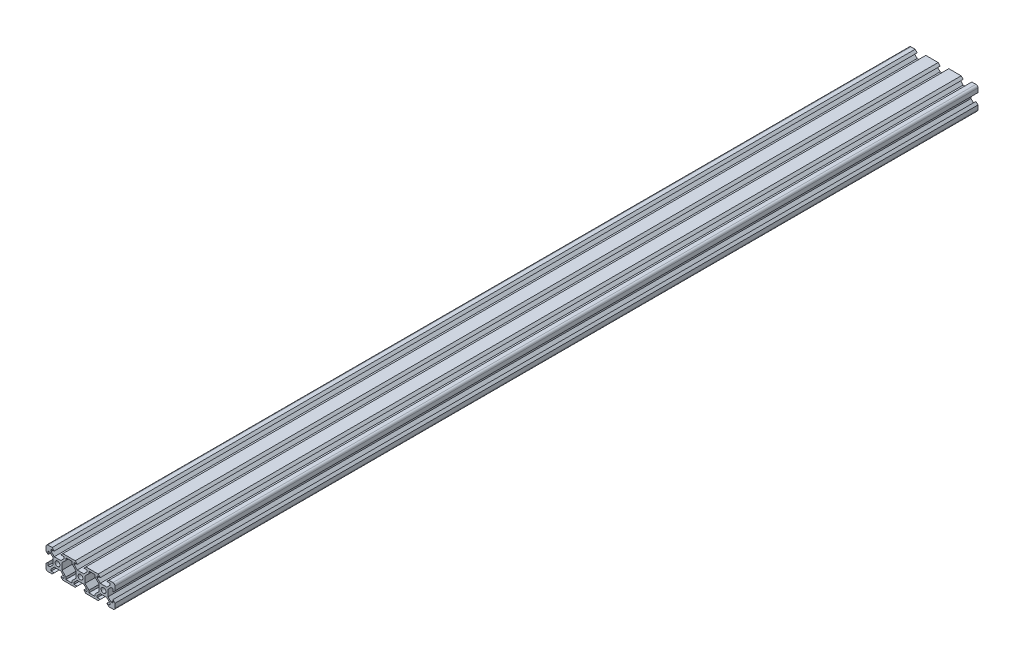
from build123d import *

# Parameters (mm, degrees)
SKETCH1_R           = 2.1
BOSS_EXTRUDE1_DEPTH = 750


with BuildPart() as part:
    # Sketch1 → Boss-Extrude1 (new body)
    with BuildSketch(Plane.XY.offset(10)):
        with BuildLine():
            Line((-12.84, -8.2), (-15.499339828, -8.2))
            Line((-15.499339828, -8.2), (-15.499339828, -6.56))
            Line((-15.499339828, -6.56), (-12.84, -3.900660172))
            Line((-12.84, -3.900660172), (-7.16, -3.900660172))
            Line((-7.16, -3.900660172), (-4.500660172, -6.56))
            Line((-4.500660172, -6.56), (-4.500660172, -8.2))
            Line((-4.500660172, -8.2), (-7.16, -8.2))
            Line((-7.16, -8.2), (-5.36, -10))
            Line((-5.36, -10), (5.36, -10))
            Line((5.36, -10), (7.16, -8.2))
            Line((7.16, -8.2), (4.500660172, -8.2))
            Line((4.500660172, -8.2), (4.500660172, -6.56))
            Line((4.500660172, -6.56), (7.16, -3.900660172))
            Line((7.16, -3.900660172), (12.84, -3.900660172))
            Line((12.84, -3.900660172), (15.499339828, -6.56))
            Line((15.499339828, -6.56), (15.499339828, -8.2))
            Line((15.499339828, -8.2), (12.84, -8.2))
            Line((12.84, -8.2), (14.64, -10))
            Line((14.64, -10), (18.2, -10))
            ThreePointArc((18.2, -10), (19.472792206, -9.472792206), (20, -8.2))
            Line((20, -8.2), (20, -4.64))
            Line((20, -4.64), (18.2, -2.84))
            Line((18.2, -2.84), (18.2, -5.499339828))
            Line((18.2, -5.499339828), (16.56, -5.499339828))
            Line((16.56, -5.499339828), (13.900660172, -2.84))
            Line((13.900660172, -2.84), (13.900660172, 2.84))
            Line((13.900660172, 2.84), (16.56, 5.499339828))
            Line((16.56, 5.499339828), (18.2, 5.499339828))
            Line((18.2, 5.499339828), (18.2, 2.84))
            Line((18.2, 2.84), (20, 4.64))
            Line((20, 4.64), (20, 8.2))
            ThreePointArc((20, 8.2), (19.472792206, 9.472792206), (18.2, 10))
            Line((18.2, 10), (14.64, 10))
            Line((14.64, 10), (12.84, 8.2))
            Line((12.84, 8.2), (15.499339828, 8.2))
            Line((15.499339828, 8.2), (15.499339828, 6.56))
            Line((15.499339828, 6.56), (12.84, 3.900660172))
            Line((12.84, 3.900660172), (7.16, 3.900660172))
            Line((7.16, 3.900660172), (4.500660172, 6.56))
            Line((4.500660172, 6.56), (4.500660172, 8.2))
            Line((4.500660172, 8.2), (7.16, 8.2))
            Line((7.16, 8.2), (5.36, 10))
            Line((5.36, 10), (-5.36, 10))
            Line((-5.36, 10), (-7.16, 8.2))
            Line((-7.16, 8.2), (-4.500660172, 8.2))
            Line((-4.500660172, 8.2), (-4.500660172, 6.56))
            Line((-4.500660172, 6.56), (-7.16, 3.900660172))
            Line((-7.16, 3.900660172), (-12.84, 3.900660172))
            Line((-12.84, 3.900660172), (-15.499339828, 6.56))
            Line((-15.499339828, 6.56), (-15.499339828, 8.2))
            Line((-15.499339828, 8.2), (-12.84, 8.2))
            Line((-12.84, 8.2), (-14.64, 10))
            Line((-14.64, 10), (-25.36, 10))
            Line((-25.36, 10), (-27.16, 8.2))
            Line((-27.16, 8.2), (-24.500660172, 8.2))
            Line((-24.500660172, 8.2), (-24.500660172, 6.56))
            Line((-24.500660172, 6.56), (-27.16, 3.900660172))
            Line((-27.16, 3.900660172), (-32.84, 3.900660172))
            Line((-32.84, 3.900660172), (-35.499339828, 6.56))
            Line((-35.499339828, 6.56), (-35.499339828, 8.2))
            Line((-35.499339828, 8.2), (-32.84, 8.2))
            Line((-32.84, 8.2), (-34.64, 10))
            Line((-34.64, 10), (-38.2, 10))
            ThreePointArc((-38.2, 10), (-39.472792206, 9.472792206), (-40, 8.2))
            Line((-40, 8.2), (-40, 4.64))
            Line((-40, 4.64), (-38.2, 2.84))
            Line((-38.2, 2.84), (-38.2, 5.499339828))
            Line((-38.2, 5.499339828), (-36.56, 5.499339828))
            Line((-36.56, 5.499339828), (-33.900660172, 2.84))
            Line((-33.900660172, 2.84), (-33.900660172, -2.84))
            Line((-33.900660172, -2.84), (-36.56, -5.499339828))
            Line((-36.56, -5.499339828), (-38.2, -5.499339828))
            Line((-38.2, -5.499339828), (-38.2, -2.84))
            Line((-38.2, -2.84), (-40, -4.64))
            Line((-40, -4.64), (-40, -8.2))
            ThreePointArc((-40, -8.2), (-39.472792206, -9.472792206), (-38.2, -10))
            Line((-38.2, -10), (-34.64, -10))
            Line((-34.64, -10), (-32.84, -8.2))
            Line((-32.84, -8.2), (-35.499339828, -8.2))
            Line((-35.499339828, -8.2), (-35.499339828, -6.56))
            Line((-35.499339828, -6.56), (-32.84, -3.900660172))
            Line((-32.84, -3.900660172), (-27.16, -3.900660172))
            Line((-27.16, -3.900660172), (-24.500660172, -6.56))
            Line((-24.500660172, -6.56), (-24.500660172, -8.2))
            Line((-24.500660172, -8.2), (-27.16, -8.2))
            Line((-27.16, -8.2), (-25.36, -10))
            Line((-25.36, -10), (-14.64, -10))
            Line((-14.64, -10), (-12.84, -8.2))
        make_face()
        with Locations(Location((-10, 0, 0), (0, 0, 180))):
            Circle(SKETCH1_R, mode=Mode.SUBTRACT)
        with Locations(Location((-30, 0, 0), (0, 0, 180))):
            Circle(SKETCH1_R, mode=Mode.SUBTRACT)
        with Locations(Location((10, 0, 0), (0, 0, 180))):
            Circle(SKETCH1_R, mode=Mode.SUBTRACT)
        Polygon((-13.900660172, 2.84), (-13.900660172, -2.84), (-17.300660172, -6.24), (-17.300660172, -8.2), (-22.699339828, -8.2), (-22.699339828, -6.24), (-26.099339828, -2.84), (-26.099339828, 2.84), (-22.699339828, 6.24), (-22.699339828, 8.2), (-17.300660172, 8.2), (-17.300660172, 6.24), align=None, mode=Mode.SUBTRACT)
        Polygon((-6.099339828, -2.84), (-6.099339828, 2.84), (-2.699339828, 6.24), (-2.699339828, 8.2), (2.699339828, 8.2), (2.699339828, 6.24), (6.099339828, 2.84), (6.099339828, -2.84), (2.699339828, -6.24), (2.699339828, -8.2), (-2.699339828, -8.2), (-2.699339828, -6.24), align=None, mode=Mode.SUBTRACT)
    extrude(amount=-BOSS_EXTRUDE1_DEPTH)


solid = part.part
